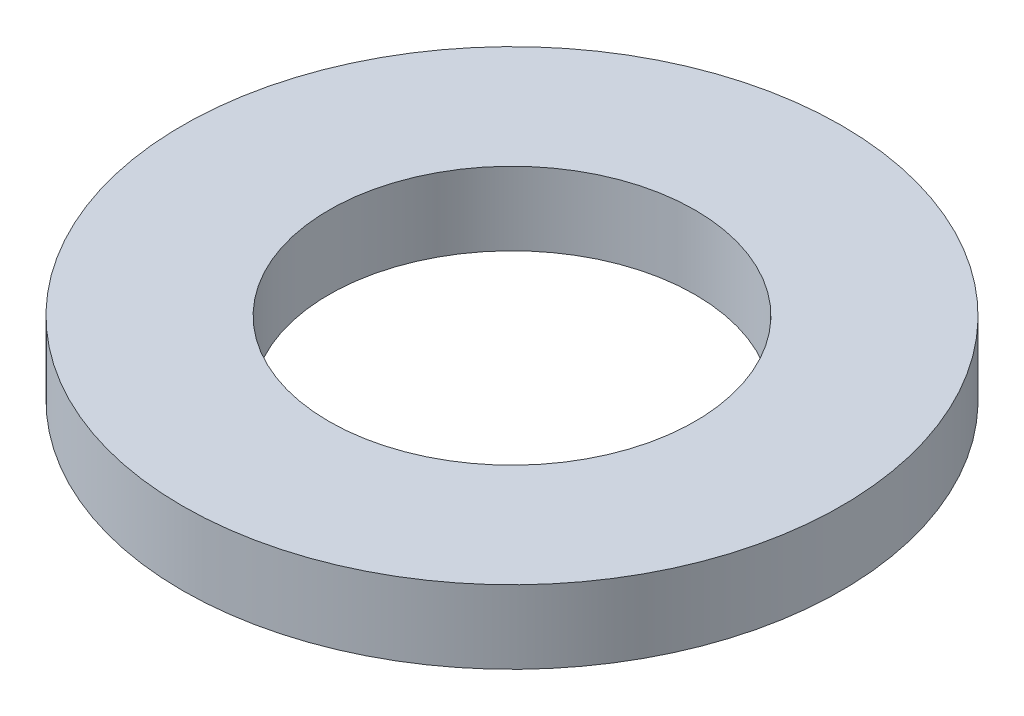
from build123d import *

# Parameters (mm, degrees)
SKETCH1_R           = 4.5
SKETCH1_R_2         = 2.5
BOSS_EXTRUDE1_DEPTH = 1


with BuildPart() as part:
    # Sketch1 → Boss-Extrude1 (new body)
    with BuildSketch(Plane(origin=(0, 0, 0), x_dir=(1, 0, 0), z_dir=(0, 1, 0))):
        with Locations(Location((12.868646323, -5, 0), (0, 0, 270))):
            Circle(SKETCH1_R)
        with Locations(Location((12.868646323, -5, 0), (0, 0, 270))):
            Circle(SKETCH1_R_2, mode=Mode.SUBTRACT)
    extrude(amount=BOSS_EXTRUDE1_DEPTH)


solid = part.part
